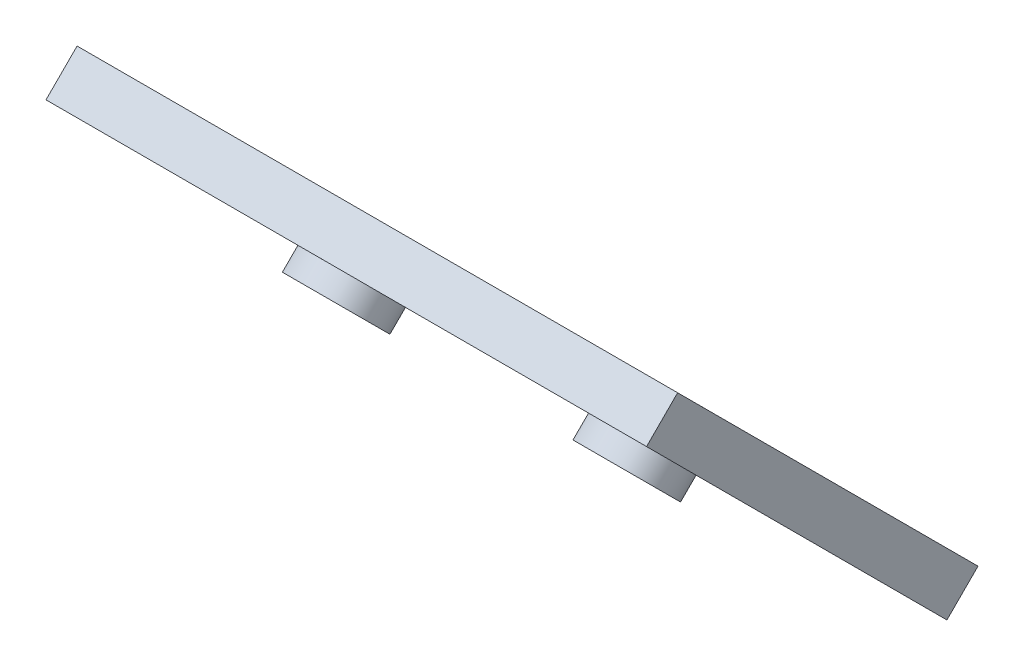
from build123d import *

# Parameters (mm, degrees)
SKETCH1_W                = 41
SKETCH1_H                = 29
BOSS_EXTRUDE1_DEPTH      = 3
SKETCH11_R               = 3
BOSS_EXTRUDE2_DEPTH      = 1.5
F_4_0_4_DIAMETER_HOLE1_D = 4
BODY_MOVE_COPY9_ANGLE    = 45


with BuildPart() as part:
    # Sketch1 → Boss-Extrude1 (new body)
    with BuildSketch(Plane.XY):
        Rectangle(SKETCH1_W, SKETCH1_H)
    extrude(amount=BOSS_EXTRUDE1_DEPTH)


with BuildPart() as part_1:
    # Body-Move/Copy1: moved
    add(part.part.moved(Location((0.5, 0.5, 0))))

    # Sketch11 → Boss-Extrude2 (add)
    with BuildSketch(Plane.XY.offset(3)):
        with Locations((-9.387244392, 0.5)):
            Circle(SKETCH11_R)
        with Locations((10.452938647, 0.5)):
            Circle(SKETCH11_R)
    extrude(amount=BOSS_EXTRUDE2_DEPTH)

    # Ø4.0 (4) Diameter Hole1 (through all)
    with Locations(Plane.XY.offset(4.5)):
        with Locations((-9.387244392, 0.5), (10.452938647, 0.5)):
            Hole(F_4_0_4_DIAMETER_HOLE1_D / 2)


with BuildPart() as part_2:
    # Body-Move/Copy8: moved
    add(part_1.part.moved(Location((27.795693281, 0, 0))))


with BuildPart() as part_3:
    # Body-Move/Copy9: moved
    add(part_2.part.rotate(Axis((0, 0.5, 2.25), (1, 0, 0)), BODY_MOVE_COPY9_ANGLE))


solid = part_3.part
